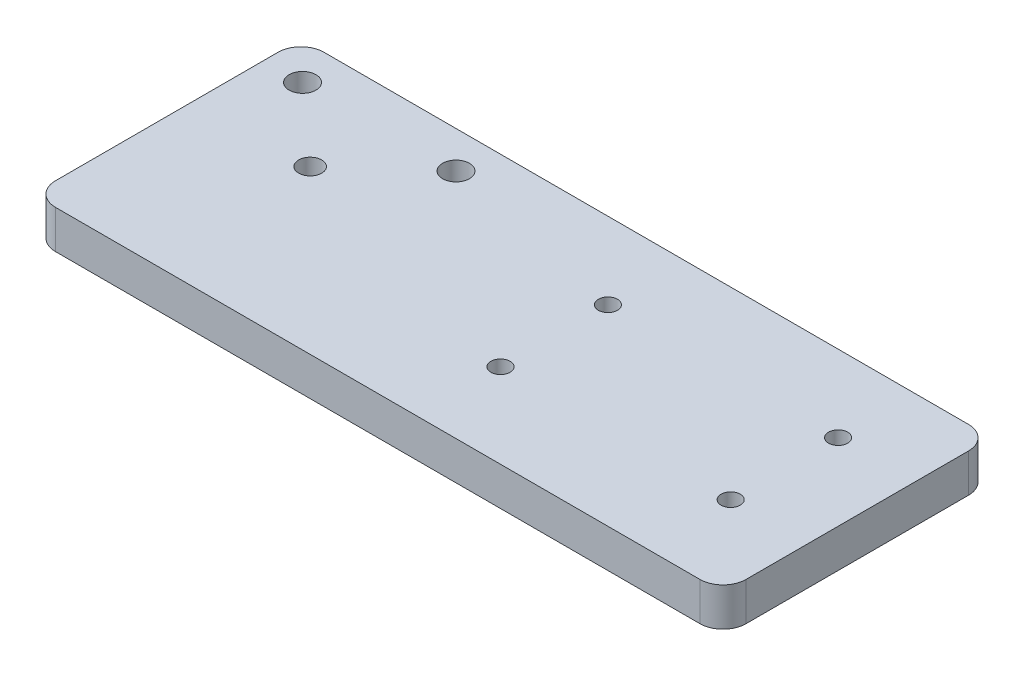
from build123d import *

# Parameters (mm, degrees)
SKETCH_1_W                  = 90
SKETCH_1_H                  = 35
EXTRUDE_1_DEPTH             = 5
SKETCH_2_R                  = 1
CUT_EXTRUDE_1_DEPTH         = 49.541219597
PATTERN_LINEAR_1_COUNT      = 2
PATTERN_LINEAR_1_PITCH      = 30
PATTERN_LINEAR_1_COUNT_DIR2 = 2
PATTERN_LINEAR_1_PITCH_DIR2 = 14
SKETCH_3_R                  = 1.75
CUT_EXTRUDE_2_DEPTH         = 49.541219597
PATTERN_LINEAR_2_COUNT      = 2
PATTERN_LINEAR_2_PITCH      = 20
SKETCH_6_R                  = 1.5
CUT_EXTRUDE_3_DEPTH         = 49.541219597
FILLET_1_R                  = 3
FILLET_2_R                  = 3
FILLET_3_R                  = 3
FILLET_4_R                  = 3
HOLE_WIZARD_M3_1_D          = 2.5


with BuildPart() as part:
    # 草图1 → 凸台-拉伸1 (new body)
    with BuildSketch(Plane(origin=(0, 0, 0), x_dir=(1, 0, 0), z_dir=(0, 1, 0))):
        Rectangle(SKETCH_1_W, SKETCH_1_H)
    extrude(amount=EXTRUDE_1_DEPTH)

    # 草图2 → 切除-拉伸1 (cut, through all)
    with BuildSketch(Plane(origin=(0, 5, 0), x_dir=(1, 0, 0), z_dir=(0, 1, 0))):
        with Locations(Location((35, 7.5, 0), (0, 0, 270))):
            Circle(SKETCH_2_R)
    cut_extrude_1 = extrude(amount=-CUT_EXTRUDE_1_DEPTH, mode=Mode.SUBTRACT)

    # 阵列(线性)1: Cut-Extrude 1 2 × 2
    with Locations(*[(-i * PATTERN_LINEAR_1_PITCH, 0, j * PATTERN_LINEAR_1_PITCH_DIR2) for i in range(PATTERN_LINEAR_1_COUNT) for j in range(PATTERN_LINEAR_1_COUNT_DIR2) if (i, j) != (0, 0)]):
        add(cut_extrude_1, mode=Mode.SUBTRACT)

    # 草图3 → 切除-拉伸2 (cut, through all)
    with BuildSketch(Plane(origin=(0, 5, 0), x_dir=(1, 0, 0), z_dir=(0, 1, 0))):
        with Locations(Location((-20, 12.7, 0), (0, 0, 270))):
            Circle(SKETCH_3_R)
    cut_extrude_2 = extrude(amount=-CUT_EXTRUDE_2_DEPTH, mode=Mode.SUBTRACT)

    # 阵列(线性)2: 切除-拉伸2 ×2
    with Locations(*[(-i * PATTERN_LINEAR_2_PITCH, 0, 0) for i in range(1, PATTERN_LINEAR_2_COUNT)]):
        add(cut_extrude_2, mode=Mode.SUBTRACT)

    # 草图6 → 切除-拉伸3 (cut, through all)
    with BuildSketch(Plane(origin=(0, 5, 0), x_dir=(1, 0, 0), z_dir=(0, 1, 0))):
        with Locations(Location((-30, 3.7, 0), (0, 0, 270))):
            Circle(SKETCH_6_R)
    extrude(amount=-CUT_EXTRUDE_3_DEPTH, mode=Mode.SUBTRACT)

    # 圆角1
    fillet_1_edges = [part.edges().sort_by_distance(p)[0] for p in [
        (-45, 2.5, 17.5),
    ]]
    fillet(fillet_1_edges, radius=FILLET_1_R)

    # 圆角2
    fillet_2_edges = [part.edges().sort_by_distance(p)[0] for p in [
        (-45, 2.5, -17.5),
    ]]
    fillet(fillet_2_edges, radius=FILLET_2_R)

    # 圆角3
    fillet_3_edges = [part.edges().sort_by_distance(p)[0] for p in [
        (45, 2.5, -17.5),
    ]]
    fillet(fillet_3_edges, radius=FILLET_3_R)

    # 圆角4
    fillet_4_edges = [part.edges().sort_by_distance(p)[0] for p in [
        (45, 2.5, 17.5),
    ]]
    fillet(fillet_4_edges, radius=FILLET_4_R)

    # M3 螺纹孔1 (through all)
    with Locations(Plane(origin=(0, 5, 0), x_dir=(1, 0, 0), z_dir=(0, 1, 0))):
        with Locations((5, 7.5), (5, -6.5), (35, 7.5), (35, -6.5)):
            Hole(HOLE_WIZARD_M3_1_D / 2)


solid = part.part
